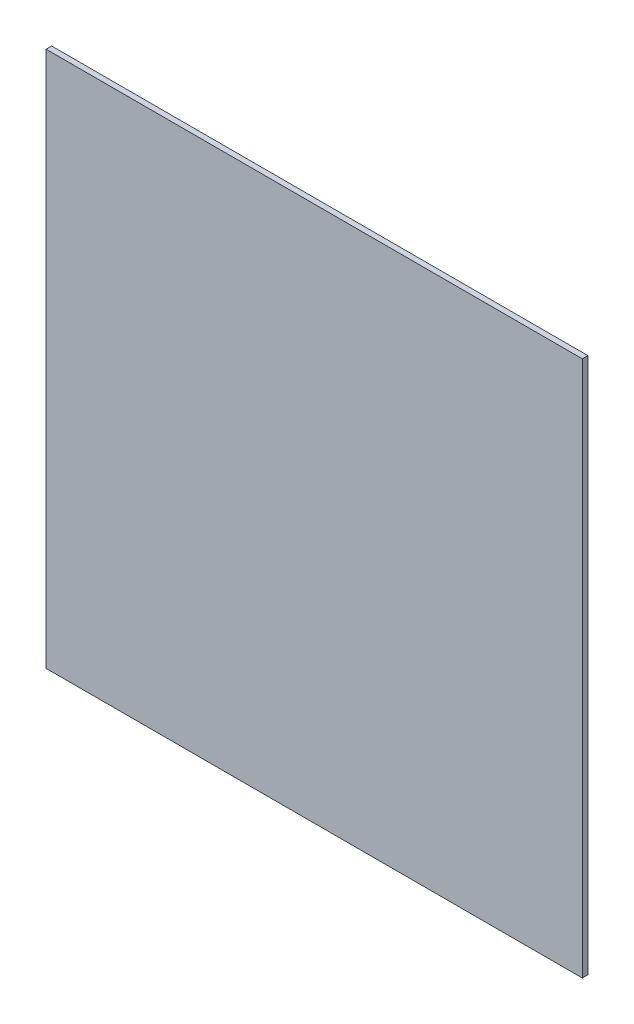
from build123d import *

# Parameters (mm, degrees)
SKETCH1_W           = 609.6
SKETCH1_H           = 609.6
BOSS_EXTRUDE1_DEPTH = 6.35


with BuildPart() as part:
    # Sketch1 → Boss-Extrude1 (new body)
    with BuildSketch(Plane.XY):
        Rectangle(SKETCH1_W, SKETCH1_H)
    extrude(amount=BOSS_EXTRUDE1_DEPTH)


solid = part.part
